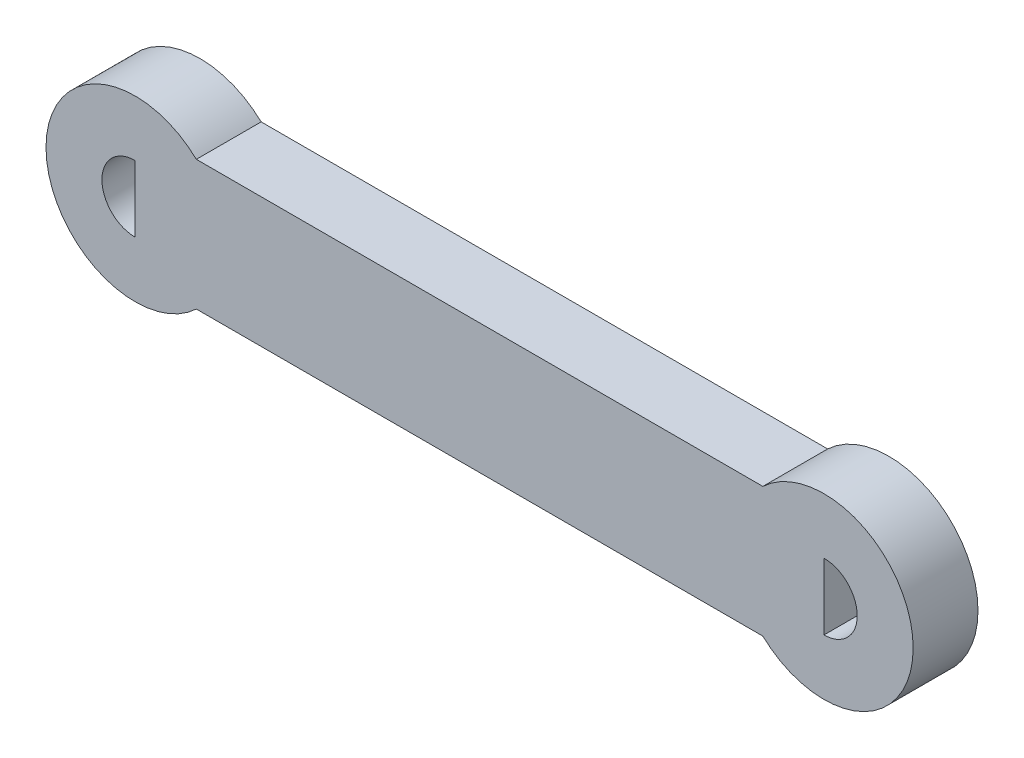
from build123d import *

# Parameters (mm, degrees)
SKETCH_1_W      = 85
SKETCH_1_H      = 16
EXTRUDE_1_DEPTH = 8
SKETCH_2_R      = 11
SKETCH_2_R_2    = 4.1
EXTRUDE_2_DEPTH = 8
SKETCH_3_R      = 11
SKETCH_3_R_2    = 4.1
EXTRUDE_3_DEPTH = 8


with BuildPart() as part:
    # 草图1 → 凸台-拉伸1 (new body)
    with BuildSketch(Plane.XY):
        with Locations((42.5, 0)):
            Rectangle(SKETCH_1_W, SKETCH_1_H)
    extrude(amount=EXTRUDE_1_DEPTH)

    # 草图2 → 凸台-拉伸2 (add)
    with BuildSketch(Plane.XY):
        Circle(SKETCH_2_R)
        Circle(SKETCH_2_R_2, mode=Mode.SUBTRACT)
    extrude(amount=EXTRUDE_2_DEPTH)

    # 草图3 → 凸台-拉伸3 (add)
    with BuildSketch(Plane.XY):
        with Locations((85, 0)):
            Circle(SKETCH_3_R)
        with Locations((85, 0)):
            Circle(SKETCH_3_R_2, mode=Mode.SUBTRACT)
    extrude(amount=EXTRUDE_3_DEPTH)


solid = part.part
